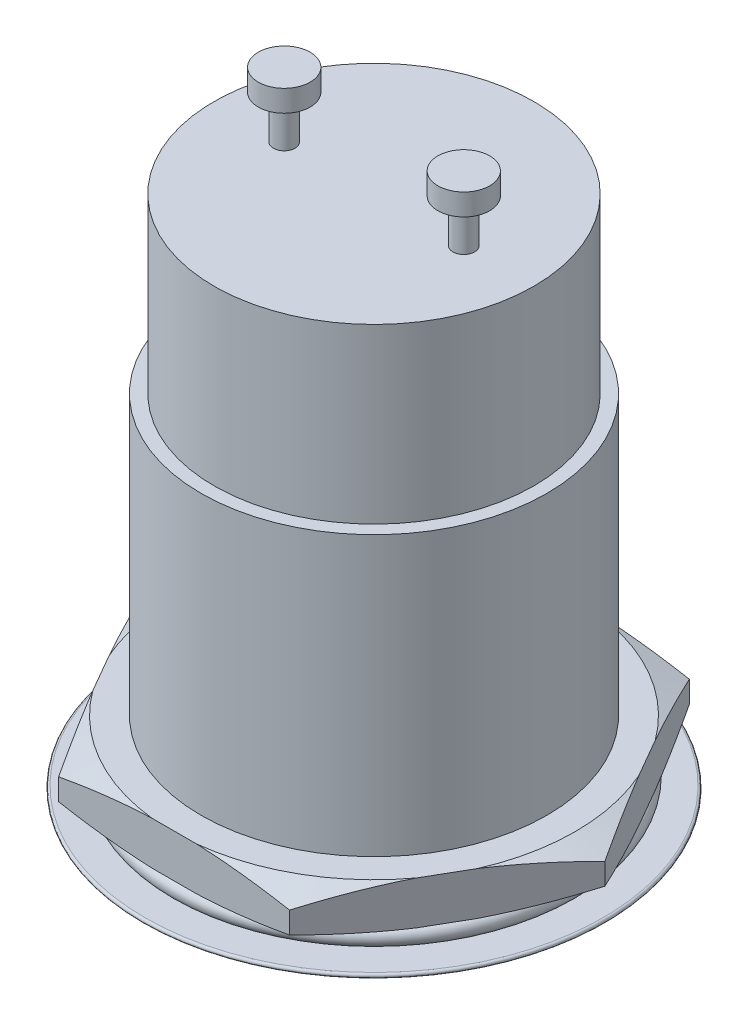
from build123d import *

# Parameters (mm, degrees)
SKETCH_2_R          = 8
EXTRUDE_1_DEPTH     = 22.9
SKETCH_4_R          = 10.68097998
EXTRUDE_3_DEPTH     = 2
CHAMFER_1_SIZE      = 0.5
CHAMFER_1_SIZE2     = 1.37373871
CHAMFER_2_SIZE      = 0.5
CHAMFER_2_SIZE2     = 1.37373871
CUT_EXTRUDE_1_DEPTH = 2
CUT_EXTRUDE_2_DEPTH = 0.1
SKETCH_9_W          = 0.6
SKETCH_9_H          = 8


with BuildPart() as part:
    # 草图2 → 凸台-拉伸1 (new body)
    with BuildSketch(Plane(origin=(0, 0, 0), x_dir=(1, 0, 0), z_dir=(0, 1, 0))):
        with Locations(Location((0, 0, 0), (0, 0, 270))):
            Circle(SKETCH_2_R)
    extrude(amount=EXTRUDE_1_DEPTH)

    # 草图4 → 凸台-拉伸3 (add)
    with BuildSketch(Plane.XZ):
        with Locations(Location((0, 0, 0), (0, 0, 270))):
            Circle(SKETCH_4_R)
    extrude(amount=-EXTRUDE_3_DEPTH)

    # 倒角1
    chamfer_1_edges = [part.edges().sort_by_distance(p)[0] for p in [
        (0, 0, 10.68097998),
    ]]
    chamfer_1_side = [part.faces().sort_by_distance(p)[0] for p in [
        (0, 1, 10.68097998),
    ]]
    chamfer(chamfer_1_edges, length=CHAMFER_1_SIZE, length2=CHAMFER_1_SIZE2, reference=chamfer_1_side[0])

    # 倒角2
    chamfer_2_edges = [part.edges().sort_by_distance(p)[0] for p in [
        (0, 2, 10.68097998),
    ]]
    chamfer_2_side = [part.faces().sort_by_distance(p)[0] for p in [
        (0, 1.25, 10.68097998),
    ]]
    chamfer(chamfer_2_edges, length=CHAMFER_2_SIZE, length2=CHAMFER_2_SIZE2, reference=chamfer_2_side[0])

    # 草图1 → 切除-拉伸1 (cut)
    with BuildSketch(Plane(origin=(0, 0, 0), x_dir=(1, 0, 0), z_dir=(0, 1, 0))):
        with BuildLine():
            Line((5.34048999, 9.25), (10.68097998, 0))
            ThreePointArc((10.68097998, 0), (9.25, 5.34048999), (5.34048999, 9.25))
        make_face()
        with BuildLine():
            Line((-5.34048999, 9.25), (5.34048999, 9.25))
            ThreePointArc((5.34048999, 9.25), (0, 10.68097998), (-5.34048999, 9.25))
        make_face()
        with BuildLine():
            ThreePointArc((5.34048999, -9.25), (9.25, -5.34048999), (10.68097998, 0))
            Line((10.68097998, 0), (5.34048999, -9.25))
        make_face()
        with BuildLine():
            ThreePointArc((-5.34048999, -9.25), (0, -10.68097998), (5.34048999, -9.25))
            Line((5.34048999, -9.25), (-5.34048999, -9.25))
        make_face()
        with BuildLine():
            ThreePointArc((-10.68097998, 0), (-9.25, -5.34048999), (-5.34048999, -9.25))
            Line((-5.34048999, -9.25), (-10.68097998, 0))
        make_face()
        with BuildLine():
            Line((-10.68097998, 0), (-5.34048999, 9.25))
            ThreePointArc((-5.34048999, 9.25), (-9.25, 5.34048999), (-10.68097998, 0))
        make_face()
    extrude(amount=CUT_EXTRUDE_1_DEPTH, mode=Mode.SUBTRACT)

    # 草图6 → 旋转1 (revolve)
    with BuildSketch(Plane.XY, mode=Mode.PRIVATE) as revolve_1_sk:
        with BuildLine():
            Line((0, 0), (9, 0))
            ThreePointArc((9, 0), (9.4, -0.4), (9, -0.8))
            Line((9, -0.8), (0, -0.8))
            Line((0, -0.8), (0, 0))
        make_face()
    revolve(revolve_1_sk.sketch.rotate(Axis((0, 0, 0), (0, -1, 0)), 270), axis=Axis((0, 0, 0), (0, -1, 0)))

    # 草图7 → 旋转2 (revolve)
    with BuildSketch(Plane.XY, mode=Mode.PRIVATE) as revolve_2_sk:
        with BuildLine():
            Line((0, -0.8), (10.6, -0.8))
            ThreePointArc((10.6, -0.8), (10.69701425, -0.875746437), (10.647058824, -0.988235294))
            Line((10.647058824, -0.988235294), (8.441176471, -2.164705882))
            ThreePointArc((8.441176471, -2.164705882), (7.98507125, -2.340285), (7.5, -2.4))
            Line((7.5, -2.4), (0, -2.4))
            Line((0, -2.4), (0, -0.8))
        make_face()
    revolve(revolve_2_sk.sketch.rotate(Axis((0, -2.4, 0), (0, 1, 0)), 90), axis=Axis((0, -2.4, 0), (0, 1, 0)))

    # 草图8 → 切除-拉伸2 (cut)
    with BuildSketch(Plane.XZ.offset(2.4)):
        with BuildLine():
            Line((-0.5, 2.169099871), (-0.5, 5.169099871))
            ThreePointArc((-0.5, 5.169099871), (0, 5.669099871), (0.5, 5.169099871))
            Line((0.5, 5.169099871), (0.5, 2.169099871))
            ThreePointArc((0.5, 2.169099871), (0, 1.669099871), (-0.5, 2.169099871))
        make_face()
        with BuildLine():
            ThreePointArc((-4.363636364, 4.11809151), (0, -6), (4.363636364, 4.11809151))
            ThreePointArc((4.363636364, 4.11809151), (3.656825707, 4.138553581), (3.636363636, 3.431742925))
            ThreePointArc((3.636363636, 3.431742925), (0, -5), (-3.636363636, 3.431742925))
            ThreePointArc((-3.636363636, 3.431742925), (-3.656825707, 4.138553581), (-4.363636364, 4.11809151))
        make_face()
    extrude(amount=-CUT_EXTRUDE_2_DEPTH, mode=Mode.SUBTRACT)

    # 草图9 → 切除-旋转1 (revolve, cut)
    with BuildSketch(Plane.XY, mode=Mode.PRIVATE) as cut_revolve_1_sk:
        with Locations((7.7, 18.9)):
            Rectangle(SKETCH_9_W, SKETCH_9_H)
    revolve(cut_revolve_1_sk.sketch.rotate(Axis((0, 0, 0), (0, 1, 0)), 90), axis=Axis((0, 0, 0), (0, 1, 0)), mode=Mode.SUBTRACT)

    # 草图10 → 旋转4 (revolve)
    with BuildSketch(Plane.XY, mode=Mode.PRIVATE) as revolve_4_sk:
        Polygon((4.153927956, 22.9), (4.653927956, 22.9), (4.653927956, 24.9), (5.353927956, 24.9), (5.353927956, 25.9), (4.153927956, 25.9), align=None)
    revolve_4 = revolve(revolve_4_sk.sketch.rotate(Axis((4.153927956, 22.9, 0), (0, 1, 0)), 90), axis=Axis((4.153927956, 22.9, 0), (0, 1, 0)))

    # 镜向1: 旋转4 across plane
    add(revolve_4.mirror(Plane(origin=(0, 0, 0), x_dir=(0, 0, 1), z_dir=(1, 0, 0))))


solid = part.part
